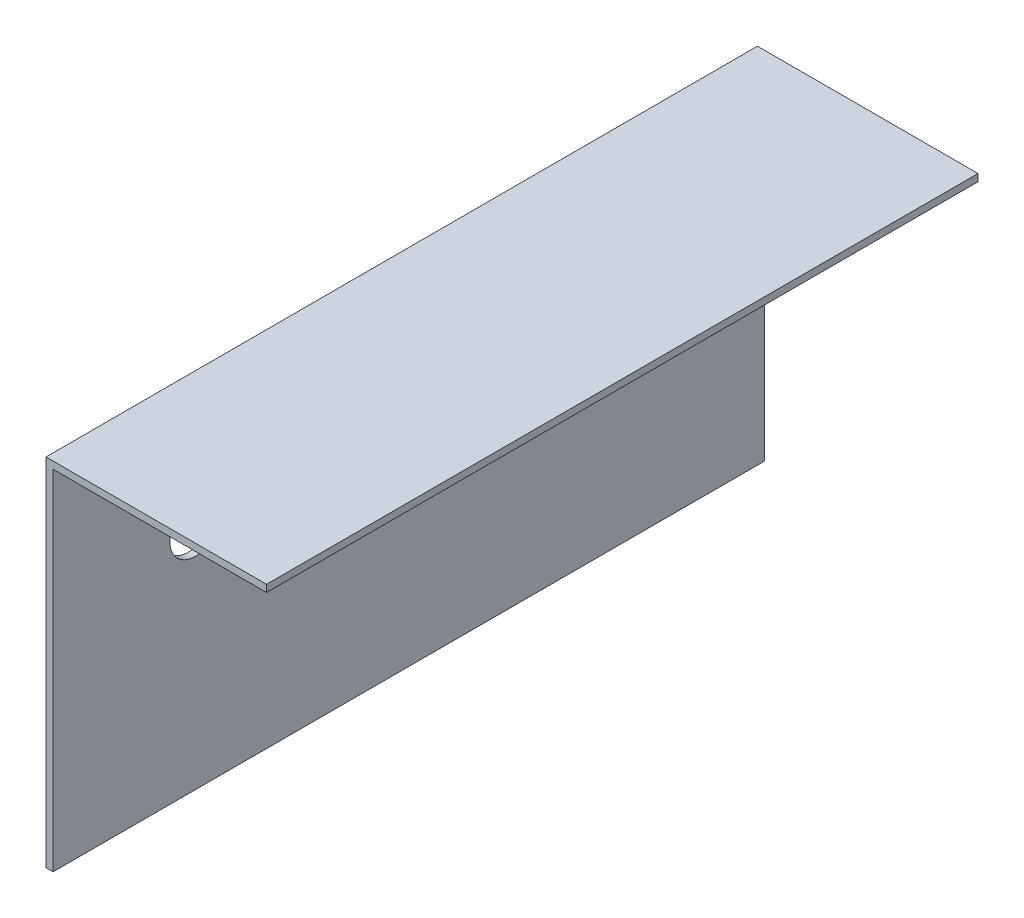
from build123d import *

# Parameters (mm, degrees)
SKETCH_1_W                  = 50
SKETCH_1_H                  = 25
EXTRUDE_1_DEPTH             = 0.5
SKETCH_2_W                  = 50
SKETCH_2_H                  = 0.5
EXTRUDE_2_DEPTH             = 15
HOLE_WIZARD_3_6_3_6_1_D     = 3.6
HOLE_WIZARD_3_6_3_6_1_DEPTH = 10
HOLE_WIZARD_3_6_3_6_1_TIP   = 1.081549114


with BuildPart() as part:
    # Эскиз1 → Бобышка-Вытянуть1 (new body)
    with BuildSketch(Plane(origin=(0, 0, 0), x_dir=(0, 0, -1), z_dir=(1, 0, 0))):
        with Locations((-31.933808614, 10.000042269)):
            Rectangle(SKETCH_1_W, SKETCH_1_H)
    extrude(amount=EXTRUDE_1_DEPTH)

    # Эскиз2 → Бобышка-Вытянуть2 (add)
    with BuildSketch(Plane(origin=(0.5, 0, 0), x_dir=(0, 0, -1), z_dir=(1, 0, 0))):
        with Locations((-31.933808614, 22.250042269)):
            Rectangle(SKETCH_2_W, SKETCH_2_H)
    extrude(amount=EXTRUDE_2_DEPTH)

    # Диаметр отверстия Ø3.6 (3.6)1
    with Locations(Plane.ZY):
        with Locations((16.933808614, 13.500042269), (46.933808614, 13.500042269)):
            Hole(HOLE_WIZARD_3_6_3_6_1_D / 2, depth=HOLE_WIZARD_3_6_3_6_1_DEPTH)
            with Locations((0, 0, -(HOLE_WIZARD_3_6_3_6_1_DEPTH + HOLE_WIZARD_3_6_3_6_1_TIP / 2))):  # 118° drill point
                Cone(0, HOLE_WIZARD_3_6_3_6_1_D / 2, HOLE_WIZARD_3_6_3_6_1_TIP, mode=Mode.SUBTRACT)


solid = part.part
